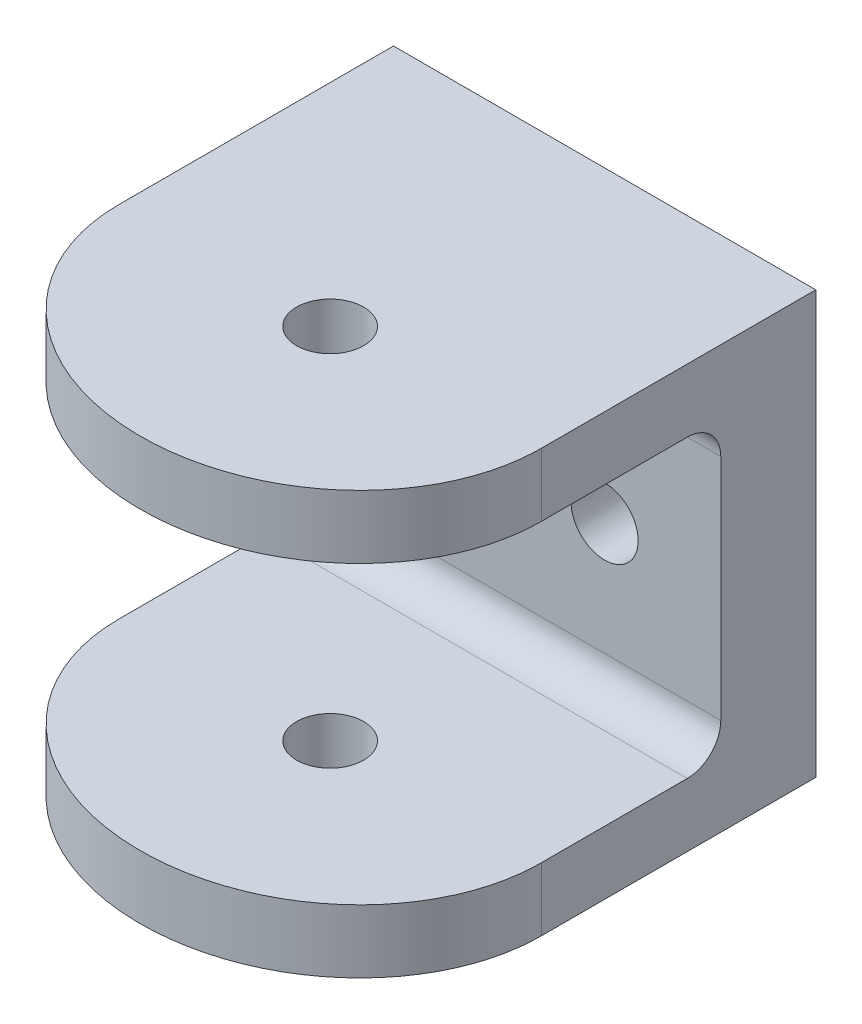
from build123d import *

# Parameters (mm, degrees)
SKETCH1_W           = 40
SKETCH1_H           = 40
SKETCH1_R           = 3.175
BOSS_EXTRUDE1_DEPTH = 9
SKETCH2_W           = 40
SKETCH2_H           = 6
BOSS_EXTRUDE2_DEPTH = 35
FILLET1_R           = 3.175
SKETCH3_R           = 3.175
CUT_EXTRUDE1_DEPTH  = 63.737548565


with BuildPart() as part:
    # Sketch1 → Boss-Extrude1 (new body)
    with BuildSketch(Plane.XY):
        Rectangle(SKETCH1_W, SKETCH1_H)
        with Locations((9, 0)):
            Circle(SKETCH1_R, mode=Mode.SUBTRACT)
        with Locations((-9, 0)):
            Circle(SKETCH1_R, mode=Mode.SUBTRACT)
    extrude(amount=BOSS_EXTRUDE1_DEPTH)

    # Sketch2 → Boss-Extrude2 (add)
    with BuildSketch(Plane.XY.offset(9)):
        with Locations((0, 17)):
            Rectangle(SKETCH2_W, SKETCH2_H)
        with Locations((0, -17)):
            Rectangle(SKETCH2_W, SKETCH2_H)
    extrude(amount=BOSS_EXTRUDE2_DEPTH)

    # Fillet1
    fillet1_edges = [part.edges().sort_by_distance(p)[0] for p in [
        (0, -14, 9),
        (0, 14, 9),
    ]]
    fillet(fillet1_edges, radius=FILLET1_R)

    # Sketch3 → Cut-Extrude1 (cut, through all)
    with BuildSketch(Plane(origin=(0, 20, 0), x_dir=(1, 0, 0), z_dir=(0, 1, 0))):
        with BuildLine():
            Line((-20, -44), (1e-09, -44))
            add(Edge.make_bspline(
                [(-20, -26), (-20, -44), (0, -44)],
                knots=[3.141592654, 3.141592654, 3.141592654, 4.71238898, 4.71238898, 4.71238898], degree=2, weights=[1, 0.707106781, 1]))
            Line((-20, -26), (-20, -44))
        make_face()
        with BuildLine():
            Line((1e-09, -44), (20, -44))
            Line((20, -44), (20, -26))
            add(Edge.make_bspline(
                [(0, -44), (20, -44), (20, -26)],
                knots=[4.71238898, 4.71238898, 4.71238898, 6.283185307, 6.283185307, 6.283185307], degree=2, weights=[1, 0.707106781, 1]))
        make_face()
        with Locations(Location((0, -26, 0), (0, 0, 270))):
            Circle(SKETCH3_R)
    extrude(amount=-CUT_EXTRUDE1_DEPTH, mode=Mode.SUBTRACT)


solid = part.part
